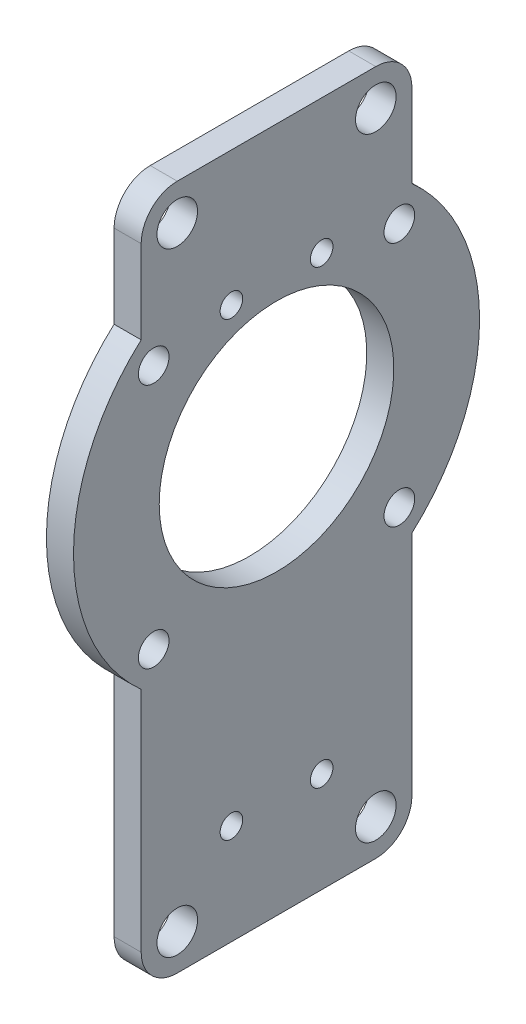
from build123d import *

# Parameters (mm, degrees)
SKETCH_1_W          = 3
SKETCH_1_H          = 30
EXTRUDE_1_DEPTH     = 76
SKETCH_2_R          = 22.5
EXTRUDE_2_DEPTH     = 3
SKETCH_3_R          = 13
CUT_EXTRUDE_1_DEPTH = 85.801238199
HOLE_WIZARD_M31_D   = 3.4
HOLE_WIZARD_M41_D   = 4.5
FILLET_1_R          = 4
M3X0_51_D           = 2.5


with BuildPart() as part:
    # Эскиз1 → Бобышка-Вытянуть1 (new body)
    with BuildSketch(Plane(origin=(0, 0, 0), x_dir=(1, 0, 0), z_dir=(0, 1, 0))):
        with Locations((1.5, -15)):
            Rectangle(SKETCH_1_W, SKETCH_1_H)
    extrude(amount=EXTRUDE_1_DEPTH)

    # Эскиз2 → Бобышка-Вытянуть2 (add)
    with BuildSketch(Plane.ZY):
        with Locations((15, 46)):
            Circle(SKETCH_2_R)
    extrude(amount=-EXTRUDE_2_DEPTH)

    # Эскиз3 → Вырез-Вытянуть1 (cut, through all)
    with BuildSketch(Plane.ZY):
        with Locations((15, 46)):
            Circle(SKETCH_3_R)
    extrude(amount=-CUT_EXTRUDE_1_DEPTH, mode=Mode.SUBTRACT)

    # Отверстие с зазором M31 (through all)
    with Locations(Plane(origin=(3, -25.024735225, 7.262908886), x_dir=(0, 0, 1), z_dir=(1, 0, 0))):
        with Locations((21.348896652, -84.636540763), (-5.874714424, -84.636540763), (-5.874714424, -57.412929688), (21.348896652, -57.412929688)):
            Hole(HOLE_WIZARD_M31_D / 2)

    # Отверстие с зазором M41 (through all)
    with Locations(Plane(origin=(3, 0, 0), x_dir=(0, 0, -1), z_dir=(1, 0, 0))):
        with Locations((-26, 72), (-4, 72), (-4, 4), (-26, 4)):
            Hole(HOLE_WIZARD_M41_D / 2)

    # Скругление1
    fillet_1_edges = [part.edges().sort_by_distance(p)[0] for p in [
        (1.5, 76, 0),
        (1.5, 0, 0),
        (1.5, 0, 30),
        (1.5, 76, 30),
    ]]
    fillet(fillet_1_edges, radius=FILLET_1_R)

    # Отверстие обработанное метчиком M3x0.51 (through all)
    with Locations(Plane.ZY):
        with Locations((10, 61.12), (20, 61.12), (10, 11.12), (20, 11.12)):
            Hole(M3X0_51_D / 2)


solid = part.part
